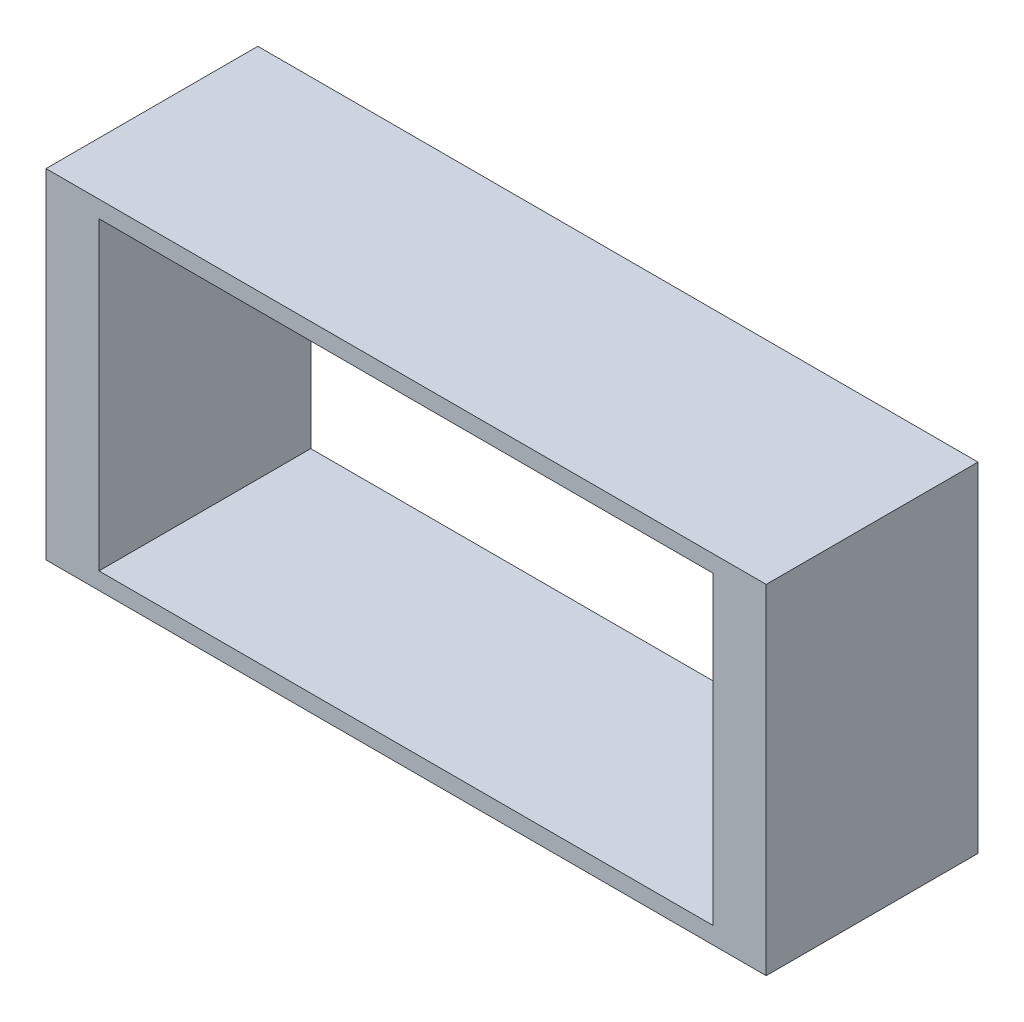
from build123d import *

# Parameters (mm, degrees)
SKETCH2_W           = 34
SKETCH2_H           = 16
SKETCH2_W_2         = 29
SKETCH2_H_2         = 14.4
BOSS_EXTRUDE3_DEPTH = 10


with BuildPart() as part:
    # Sketch2 → Boss-Extrude3 (new body)
    with BuildSketch(Plane.XY):
        with Locations((17, -8)):
            Rectangle(SKETCH2_W, SKETCH2_H)
        with Locations((17, -8)):
            Rectangle(SKETCH2_W_2, SKETCH2_H_2, mode=Mode.SUBTRACT)
    extrude(amount=BOSS_EXTRUDE3_DEPTH)


solid = part.part
